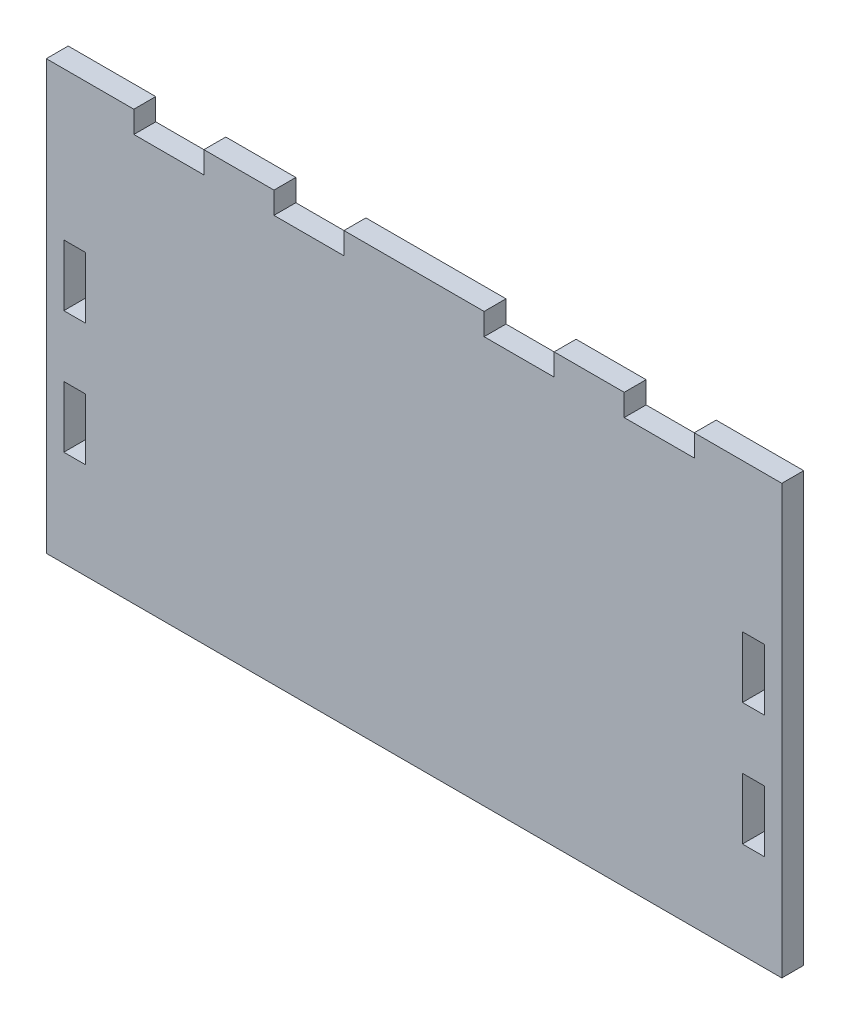
from build123d import *

# Parameters (mm, degrees)
SKETCH1_W           = 2.5
SKETCH1_H           = 7
BOSS_EXTRUDE1_DEPTH = 2.5


with BuildPart() as part:
    # Sketch1 → Boss-Extrude1 (new body)
    with BuildSketch(Plane.XY):
        Polygon((-24, 24.4632035), (-24, 21.9632035), (-32, 21.9632035), (-32, 24.4632035), (-42, 24.4632035), (-42, -24.4632035), (42, -24.4632035), (42, 24.4632035), (32, 24.4632035), (32, 21.9632035), (24, 21.9632035), (24, 24.4632035), (16, 24.4632035), (16, 21.9632035), (8, 21.9632035), (8, 24.4632035), (-8, 24.4632035), (-8, 21.9632035), (-16, 21.9632035), (-16, 24.4632035), align=None)
        with Locations((38.75, 4.0367965)):
            Rectangle(SKETCH1_W, SKETCH1_H, mode=Mode.SUBTRACT)
        with Locations((-38.75, -9.9632035)):
            Rectangle(SKETCH1_W, SKETCH1_H, mode=Mode.SUBTRACT)
        with Locations((38.75, -9.9632035)):
            Rectangle(SKETCH1_W, SKETCH1_H, mode=Mode.SUBTRACT)
        with Locations((-38.75, 4.0367965)):
            Rectangle(SKETCH1_W, SKETCH1_H, mode=Mode.SUBTRACT)
    extrude(amount=BOSS_EXTRUDE1_DEPTH)


solid = part.part
